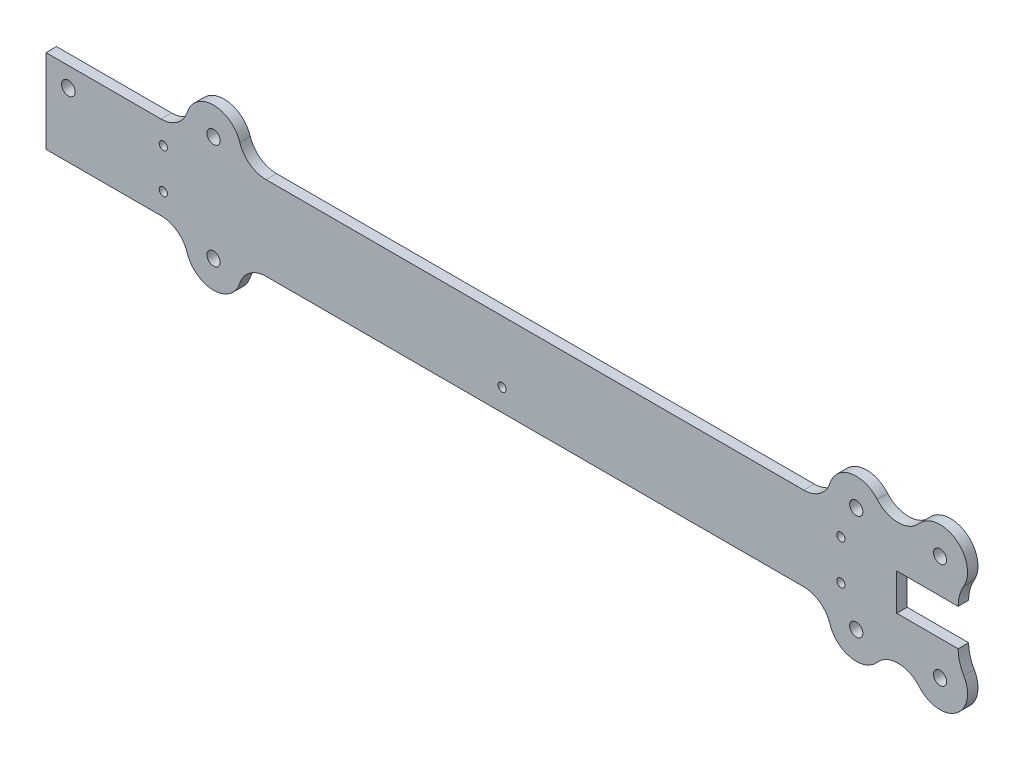
from build123d import *

# Parameters (mm, degrees)
SKETCH1_R           = 4.127
SKETCH1_R_2         = 4
SKETCH1_R_3         = 2.4892
BOSS_EXTRUDE1_DEPTH = 6.35


with BuildPart() as part:
    # Sketch1 → Boss-Extrude1 (new body)
    with BuildSketch(Plane.XY):
        with BuildLine():
            Line((0, 50.8), (69.782797106, 50.8))
            ThreePointArc((69.782797106, 50.8), (79.63302553, 54.01434095), (85.691398553, 62.42))
            ThreePointArc((85.691398553, 62.42), (101.6, 74.04), (117.508601447, 62.42))
            ThreePointArc((117.508601447, 62.42), (123.56697447, 54.01434095), (133.417202894, 50.8))
            Line((133.417202894, 50.8), (459.482797106, 50.8))
            ThreePointArc((459.482797106, 50.8), (469.33302553, 54.01434095), (475.391398553, 62.42))
            ThreePointArc((475.391398553, 62.42), (488.001405867, 73.710988875), (504, 68.184353369))
            ThreePointArc((504, 68.184353369), (516.7, 62.328706739), (529.4, 68.184353369))
            ThreePointArc((529.4, 68.184353369), (551.811441752, 70.92594491), (556.471129688, 48.833494754))
            ThreePointArc((556.471129688, 48.833494754), (553.958009173, 42.90331161), (553.1, 36.52))
            Line((553.1, 36.52), (515.860000058, 36.52))
            Line((515.860000058, 36.52), (515.860000058, 14.28))
            Line((515.860000058, 14.28), (553.1, 14.28))
            ThreePointArc((553.1, 14.28), (553.958009173, 7.89668839), (556.471129688, 1.966505246))
            ThreePointArc((556.471129688, 1.966505246), (551.811441752, -20.12594491), (529.4, -17.384353369))
            ThreePointArc((529.4, -17.384353369), (516.7, -11.528706739), (504, -17.384353369))
            ThreePointArc((504, -17.384353369), (488.001405867, -22.910988875), (475.391398553, -11.62))
            ThreePointArc((475.391398553, -11.62), (469.33302553, -3.21434095), (459.482797106, 0))
            Line((459.482797106, 0), (133.417202894, 0))
            ThreePointArc((133.417202894, 0), (123.56697447, -3.21434095), (117.508601447, -11.62))
            ThreePointArc((117.508601447, -11.62), (101.6, -23.24), (85.691398553, -11.62))
            ThreePointArc((85.691398553, -11.62), (79.63302553, -3.21434095), (69.782797106, 0))
            Line((69.782797106, 0), (0, 0))
            Line((0, 0), (0, 50.8))
        make_face()
        with Locations((13.54, 38.94)):
            Circle(SKETCH1_R, mode=Mode.SUBTRACT)
        with Locations(Location((101.6, -6.54, 0), (0, 0, 180))):
            Circle(SKETCH1_R_2, mode=Mode.SUBTRACT)
        with Locations((481.98, 13.3425)):
            Circle(SKETCH1_R_3, mode=Mode.SUBTRACT)
        with Locations((481.98, 37.4575)):
            Circle(SKETCH1_R_3, mode=Mode.SUBTRACT)
        with Locations((276.55, 13.3425)):
            Circle(SKETCH1_R_3, mode=Mode.SUBTRACT)
        with Locations((71.12, 13.3425)):
            Circle(SKETCH1_R_3, mode=Mode.SUBTRACT)
        with Locations((71.12, 37.4575)):
            Circle(SKETCH1_R_3, mode=Mode.SUBTRACT)
        with Locations((101.6, 57.34)):
            Circle(SKETCH1_R_2, mode=Mode.SUBTRACT)
        with Locations((491.3, 57.34)):
            Circle(SKETCH1_R_2, mode=Mode.SUBTRACT)
        with Locations((542.1, 57.34)):
            Circle(SKETCH1_R_2, mode=Mode.SUBTRACT)
        with Locations(Location((542.1, -6.54, 0), (0, 0, 180))):
            Circle(SKETCH1_R_2, mode=Mode.SUBTRACT)
        with Locations(Location((491.3, -6.54, 0), (0, 0, 180))):
            Circle(SKETCH1_R_2, mode=Mode.SUBTRACT)
    extrude(amount=BOSS_EXTRUDE1_DEPTH)


solid = part.part
